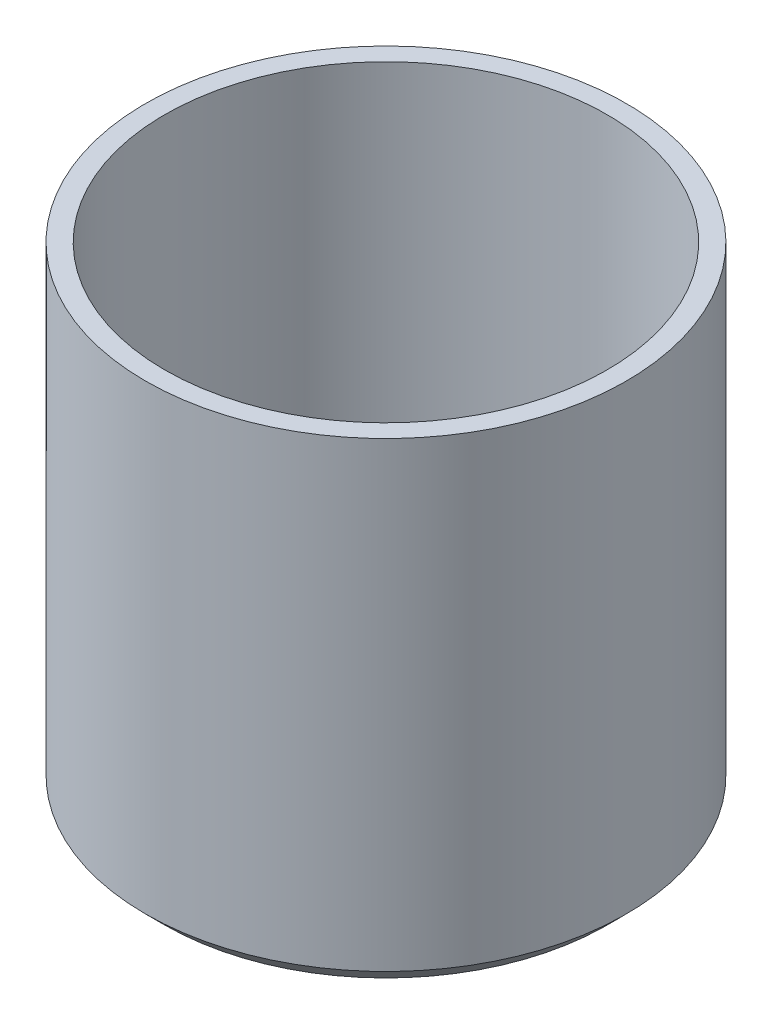
from build123d import *

# Parameters (mm, degrees)
SKETCH1_R           = 12.5
BOSS_EXTRUDE1_DEPTH = 25
SKETCH2_R           = 11.5
CUT_EXTRUDE1_DEPTH  = 24
CUT_EXTRUDE2_REACH  = 32.619
SKETCH3_R           = 1
CHAMFER1_SIZE       = 1


with BuildPart() as part:
    # Sketch1 → Boss-Extrude1 (new body)
    with BuildSketch(Plane(origin=(0, 0, 0), x_dir=(1, 0, 0), z_dir=(0, 1, 0))):
        with Locations(Location((0, 0, 0), (0, 0, 270))):
            Circle(SKETCH1_R)
    extrude(amount=BOSS_EXTRUDE1_DEPTH)

    # Sketch2 → Cut-Extrude1 (cut)
    with BuildSketch(Plane(origin=(0, 25, 0), x_dir=(1, 0, 0), z_dir=(0, 1, 0))):
        with Locations(Location((0, 0, 0), (0, 0, 270))):
            Circle(SKETCH2_R)
    extrude(amount=-CUT_EXTRUDE1_DEPTH, mode=Mode.SUBTRACT)

    # Sketch3 → Cut-Extrude2 (cut, up to next)
    with BuildSketch(Plane.XZ, mode=Mode.PRIVATE) as cut_extrude2_sk1:
        with Locations(Location((0, 0, 0), (0, 0, 270))):
            Circle(SKETCH3_R)
    cut_extrude2_tool1 = extrude(cut_extrude2_sk1.sketch, amount=-CUT_EXTRUDE2_REACH, mode=Mode.PRIVATE) & part.part
    # Sketch3 → Cut-Extrude2 (cut, up to next)
    with BuildSketch(Plane.XZ, mode=Mode.PRIVATE) as cut_extrude2_sk2:
        with Locations(Location((-2.828427125, 2.828427125, 0), (0, 0, 270))):
            Circle(SKETCH3_R)
    cut_extrude2_tool2 = extrude(cut_extrude2_sk2.sketch, amount=-CUT_EXTRUDE2_REACH, mode=Mode.PRIVATE) & part.part
    # Sketch3 → Cut-Extrude2 (cut, up to next)
    with BuildSketch(Plane.XZ, mode=Mode.PRIVATE) as cut_extrude2_sk3:
        with Locations(Location((-5.656854249, 5.656854249, 0), (0, 0, 270))):
            Circle(SKETCH3_R)
    cut_extrude2_tool3 = extrude(cut_extrude2_sk3.sketch, amount=-CUT_EXTRUDE2_REACH, mode=Mode.PRIVATE) & part.part
    # Sketch3 → Cut-Extrude2 (cut, up to next)
    with BuildSketch(Plane.XZ, mode=Mode.PRIVATE) as cut_extrude2_sk4:
        with Locations(Location((0, 8, 0), (0, 0, 270))):
            Circle(SKETCH3_R)
    cut_extrude2_tool4 = extrude(cut_extrude2_sk4.sketch, amount=-CUT_EXTRUDE2_REACH, mode=Mode.PRIVATE) & part.part
    # Sketch3 → Cut-Extrude2 (cut, up to next)
    with BuildSketch(Plane.XZ, mode=Mode.PRIVATE) as cut_extrude2_sk5:
        with Locations(Location((0, 4, 0), (0, 0, 270))):
            Circle(SKETCH3_R)
    cut_extrude2_tool5 = extrude(cut_extrude2_sk5.sketch, amount=-CUT_EXTRUDE2_REACH, mode=Mode.PRIVATE) & part.part
    # Sketch3 → Cut-Extrude2 (cut, up to next)
    with BuildSketch(Plane.XZ, mode=Mode.PRIVATE) as cut_extrude2_sk6:
        with Locations(Location((2.828427125, 2.828427125, 0), (0, 0, 270))):
            Circle(SKETCH3_R)
    cut_extrude2_tool6 = extrude(cut_extrude2_sk6.sketch, amount=-CUT_EXTRUDE2_REACH, mode=Mode.PRIVATE) & part.part
    # Sketch3 → Cut-Extrude2 (cut, up to next)
    with BuildSketch(Plane.XZ, mode=Mode.PRIVATE) as cut_extrude2_sk7:
        with Locations(Location((5.656854249, 5.656854249, 0), (0, 0, 270))):
            Circle(SKETCH3_R)
    cut_extrude2_tool7 = extrude(cut_extrude2_sk7.sketch, amount=-CUT_EXTRUDE2_REACH, mode=Mode.PRIVATE) & part.part
    # Sketch3 → Cut-Extrude2 (cut, up to next)
    with BuildSketch(Plane.XZ, mode=Mode.PRIVATE) as cut_extrude2_sk8:
        with Locations(Location((8, 0, 0), (0, 0, 270))):
            Circle(SKETCH3_R)
    cut_extrude2_tool8 = extrude(cut_extrude2_sk8.sketch, amount=-CUT_EXTRUDE2_REACH, mode=Mode.PRIVATE) & part.part
    # Sketch3 → Cut-Extrude2 (cut, up to next)
    with BuildSketch(Plane.XZ, mode=Mode.PRIVATE) as cut_extrude2_sk9:
        with Locations(Location((4, 0, 0), (0, 0, 270))):
            Circle(SKETCH3_R)
    cut_extrude2_tool9 = extrude(cut_extrude2_sk9.sketch, amount=-CUT_EXTRUDE2_REACH, mode=Mode.PRIVATE) & part.part
    # Sketch3 → Cut-Extrude2 (cut, up to next)
    with BuildSketch(Plane.XZ, mode=Mode.PRIVATE) as cut_extrude2_sk10:
        with Locations(Location((2.828427125, -2.828427125, 0), (0, 0, 270))):
            Circle(SKETCH3_R)
    cut_extrude2_tool10 = extrude(cut_extrude2_sk10.sketch, amount=-CUT_EXTRUDE2_REACH, mode=Mode.PRIVATE) & part.part
    # Sketch3 → Cut-Extrude2 (cut, up to next)
    with BuildSketch(Plane.XZ, mode=Mode.PRIVATE) as cut_extrude2_sk11:
        with Locations(Location((5.656854249, -5.656854249, 0), (0, 0, 270))):
            Circle(SKETCH3_R)
    cut_extrude2_tool11 = extrude(cut_extrude2_sk11.sketch, amount=-CUT_EXTRUDE2_REACH, mode=Mode.PRIVATE) & part.part
    # Sketch3 → Cut-Extrude2 (cut, up to next)
    with BuildSketch(Plane.XZ, mode=Mode.PRIVATE) as cut_extrude2_sk12:
        with Locations(Location((0, -4, 0), (0, 0, 270))):
            Circle(SKETCH3_R)
    cut_extrude2_tool12 = extrude(cut_extrude2_sk12.sketch, amount=-CUT_EXTRUDE2_REACH, mode=Mode.PRIVATE) & part.part
    # Sketch3 → Cut-Extrude2 (cut, up to next)
    with BuildSketch(Plane.XZ, mode=Mode.PRIVATE) as cut_extrude2_sk13:
        with Locations(Location((-2.828427125, -2.828427125, 0), (0, 0, 270))):
            Circle(SKETCH3_R)
    cut_extrude2_tool13 = extrude(cut_extrude2_sk13.sketch, amount=-CUT_EXTRUDE2_REACH, mode=Mode.PRIVATE) & part.part
    # Sketch3 → Cut-Extrude2 (cut, up to next)
    with BuildSketch(Plane.XZ, mode=Mode.PRIVATE) as cut_extrude2_sk14:
        with Locations(Location((-4, 0, 0), (0, 0, 270))):
            Circle(SKETCH3_R)
    cut_extrude2_tool14 = extrude(cut_extrude2_sk14.sketch, amount=-CUT_EXTRUDE2_REACH, mode=Mode.PRIVATE) & part.part
    # Sketch3 → Cut-Extrude2 (cut, up to next)
    with BuildSketch(Plane.XZ, mode=Mode.PRIVATE) as cut_extrude2_sk15:
        with Locations(Location((-8, 0, 0), (0, 0, 270))):
            Circle(SKETCH3_R)
    cut_extrude2_tool15 = extrude(cut_extrude2_sk15.sketch, amount=-CUT_EXTRUDE2_REACH, mode=Mode.PRIVATE) & part.part
    # Sketch3 → Cut-Extrude2 (cut, up to next)
    with BuildSketch(Plane.XZ, mode=Mode.PRIVATE) as cut_extrude2_sk16:
        with Locations(Location((-5.656854249, -5.656854249, 0), (0, 0, 270))):
            Circle(SKETCH3_R)
    cut_extrude2_tool16 = extrude(cut_extrude2_sk16.sketch, amount=-CUT_EXTRUDE2_REACH, mode=Mode.PRIVATE) & part.part
    # Sketch3 → Cut-Extrude2 (cut, up to next)
    with BuildSketch(Plane.XZ, mode=Mode.PRIVATE) as cut_extrude2_sk17:
        with Locations(Location((0, -8, 0), (0, 0, 270))):
            Circle(SKETCH3_R)
    cut_extrude2_tool17 = extrude(cut_extrude2_sk17.sketch, amount=-CUT_EXTRUDE2_REACH, mode=Mode.PRIVATE) & part.part
    add(cut_extrude2_tool1.solids().sort_by_distance((0, 0, 0))[0], mode=Mode.SUBTRACT)
    add(cut_extrude2_tool2.solids().sort_by_distance((-2.828427, 0, 2.828427))[0], mode=Mode.SUBTRACT)
    add(cut_extrude2_tool3.solids().sort_by_distance((-5.656854, 0, 5.656854))[0], mode=Mode.SUBTRACT)
    add(cut_extrude2_tool4.solids().sort_by_distance((0, 0, 8))[0], mode=Mode.SUBTRACT)
    add(cut_extrude2_tool5.solids().sort_by_distance((0, 0, 4))[0], mode=Mode.SUBTRACT)
    add(cut_extrude2_tool6.solids().sort_by_distance((2.828427, 0, 2.828427))[0], mode=Mode.SUBTRACT)
    add(cut_extrude2_tool7.solids().sort_by_distance((5.656854, 0, 5.656854))[0], mode=Mode.SUBTRACT)
    add(cut_extrude2_tool8.solids().sort_by_distance((8, 0, 0))[0], mode=Mode.SUBTRACT)
    add(cut_extrude2_tool9.solids().sort_by_distance((4, 0, 0))[0], mode=Mode.SUBTRACT)
    add(cut_extrude2_tool10.solids().sort_by_distance((2.828427, 0, -2.828427))[0], mode=Mode.SUBTRACT)
    add(cut_extrude2_tool11.solids().sort_by_distance((5.656854, 0, -5.656854))[0], mode=Mode.SUBTRACT)
    add(cut_extrude2_tool12.solids().sort_by_distance((0, 0, -4))[0], mode=Mode.SUBTRACT)
    add(cut_extrude2_tool13.solids().sort_by_distance((-2.828427, 0, -2.828427))[0], mode=Mode.SUBTRACT)
    add(cut_extrude2_tool14.solids().sort_by_distance((-4, 0, 0))[0], mode=Mode.SUBTRACT)
    add(cut_extrude2_tool15.solids().sort_by_distance((-8, 0, 0))[0], mode=Mode.SUBTRACT)
    add(cut_extrude2_tool16.solids().sort_by_distance((-5.656854, 0, -5.656854))[0], mode=Mode.SUBTRACT)
    add(cut_extrude2_tool17.solids().sort_by_distance((0, 0, -8))[0], mode=Mode.SUBTRACT)

    # Chamfer1
    chamfer1_edges = [part.edges().sort_by_distance(p)[0] for p in [
        (0, 0, -12.5),
        (0, 1, -11.5),
    ]]
    chamfer(chamfer1_edges, length=CHAMFER1_SIZE)


solid = part.part
